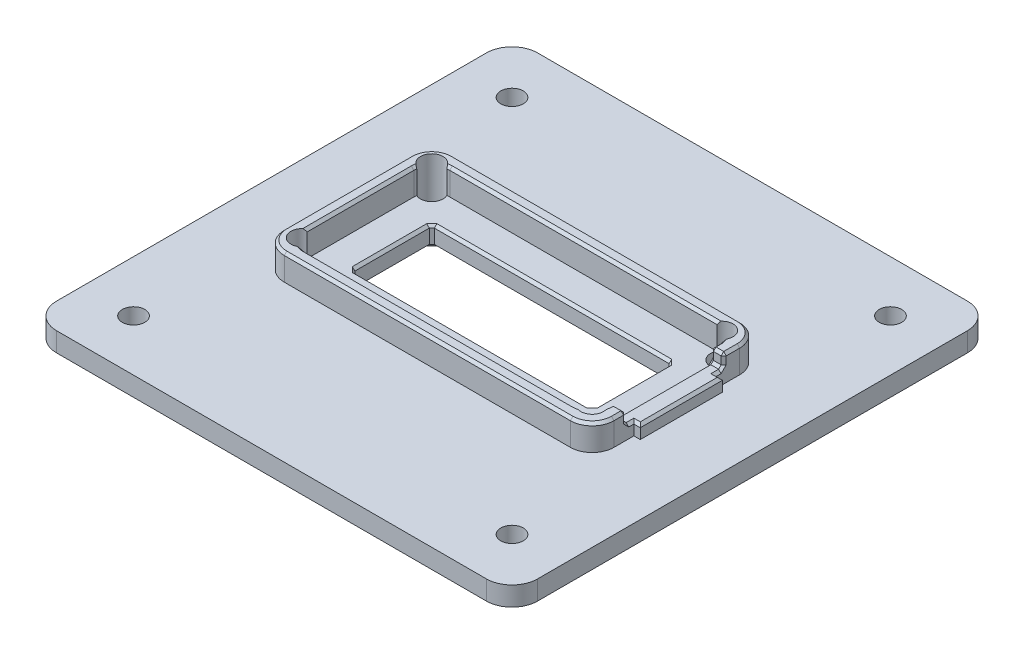
from build123d import *

# Parameters (mm, degrees)
SKETCH_1_W                      = 75
SKETCH_1_H                      = 75
SKETCH_1_R                      = 1.75
SKETCH_1_W_2                    = 37.4
SKETCH_1_H_2                    = 12.4
EXTRUDE_1_DEPTH                 = 3
SKETCH_2_W                      = 51.4
SKETCH_2_H                      = 26.4
SKETCH_2_W_2                    = 47.4
SKETCH_2_H_2                    = 22.4
EXTRUDE_2_DEPTH                 = 4
SKETCH_3_W                      = 2
SKETCH_3_H                      = 15.2
CUT_EXTRUDE_1_DEPTH             = 2
SKETCH_4_W                      = 1
SKETCH_4_H                      = 12.8
EXTRUDE_3_DEPTH                 = 2
FILLET_1_R                      = 2.8
FILLET_2_R                      = 3.4
CHAMFER_1_SIZE                  = 0.4
CUT_EXTRUDE_2_REACH             = 55.184
SKETCH_5_R                      = 1.75
CUT_EXTRUDE_2_DIRECTION_2_DEPTH = 54.183644102
FILLET_3_R                      = 4


with BuildPart() as part:
    # 草图1 → 凸台-拉伸1 (new body)
    with BuildSketch(Plane(origin=(0, 0, 0), x_dir=(1, 0, 0), z_dir=(0, 1, 0))):
        Rectangle(SKETCH_1_W, SKETCH_1_H)
        with Locations(Location((-29.5, 29.5, 0), (0, 0, 270))):
            Circle(SKETCH_1_R, mode=Mode.SUBTRACT)
        with Locations(Location((29.5, 29.5, 0), (0, 0, 270))):
            Circle(SKETCH_1_R, mode=Mode.SUBTRACT)
        with Locations(Location((29.5, -29.5, 0), (0, 0, 270))):
            Circle(SKETCH_1_R, mode=Mode.SUBTRACT)
        with Locations(Location((-29.5, -29.5, 0), (0, 0, 270))):
            Circle(SKETCH_1_R, mode=Mode.SUBTRACT)
        Rectangle(SKETCH_1_W_2, SKETCH_1_H_2, mode=Mode.SUBTRACT)
    extrude(amount=EXTRUDE_1_DEPTH)

    # 草图2 → 凸台-拉伸2 (add)
    with BuildSketch(Plane(origin=(0, 3, 0), x_dir=(1, 0, 0), z_dir=(0, 1, 0))):
        Rectangle(SKETCH_2_W, SKETCH_2_H)
        Rectangle(SKETCH_2_W_2, SKETCH_2_H_2, mode=Mode.SUBTRACT)
    extrude(amount=EXTRUDE_2_DEPTH)

    # 草图3 → 切除-拉伸1 (cut)
    with BuildSketch(Plane(origin=(0, 7, 0), x_dir=(1, 0, 0), z_dir=(0, 1, 0))):
        with Locations((24.7, -0.3)):
            Rectangle(SKETCH_3_W, SKETCH_3_H)
    extrude(amount=-CUT_EXTRUDE_1_DEPTH, mode=Mode.SUBTRACT)

    # 草图4 → 凸台-拉伸3 (add)
    with BuildSketch(Plane(origin=(0, 3, 0), x_dir=(1, 0, 0), z_dir=(0, 1, 0))):
        with Locations((26.2, -0.3)):
            Rectangle(SKETCH_4_W, SKETCH_4_H)
    extrude(amount=EXTRUDE_3_DEPTH)

    # 圆角1
    fillet_1_edges = [part.edges().sort_by_distance(p)[0] for p in [
        (23.7, 5, -11.2),
        (-23.7, 5, -11.2),
        (-23.7, 5, 11.2),
        (23.7, 5, 11.2),
    ]]
    fillet(fillet_1_edges, radius=FILLET_1_R)

    # 圆角2
    fillet_2_edges = [part.edges().sort_by_distance(p)[0] for p in [
        (25.7, 5, 13.2),
        (25.7, 5, -13.2),
        (-25.7, 5, -13.2),
        (-25.7, 5, 13.2),
    ]]
    fillet(fillet_2_edges, radius=FILLET_2_R)

    # 倒角1
    chamfer_1_edges = [part.edges().sort_by_distance(p)[0] for p in [
        (0, 7, 11.2),
        (23.7, 7, 8.15),
        (-23.7, 7, 0),
        (0, 7, -11.2),
        (22.879898987, 7, 10.379898987),
        (-22.879898987, 7, 10.379898987),
        (22.879898987, 7, -10.379898987),
        (-22.879898987, 7, -10.379898987),
        (0, 7, -13.2),
        (-25.7, 7, 0),
        (0, 7, 13.2),
        (25.7, 7, 8.85),
        (-24.704163056, 7, -12.204163056),
        (-24.704163056, 7, 12.204163056),
        (24.704163056, 7, 12.204163056),
        (24.704163056, 7, -12.204163056),
        (18.7, 0, 0),
        (18.7, 1.5, 6.2),
        (0, 0, -6.2),
        (18.7, 1.5, -6.2),
        (-18.7, 0, 0),
        (-18.7, 1.5, -6.2),
        (0, 0, 6.2),
        (-18.7, 1.5, 6.2),
        (18.7, 3, 0),
        (0, 3, -6.2),
        (-18.7, 3, 0),
        (0, 3, 6.2),
        (23.7, 7, -7.85),
        (25.7, 7, -8.55),
        (23.7, 5, 0.3),
        (23.7, 6, 7.9),
        (24.7, 5, -7.3),
        (23.7, 6, -7.3),
        (25.7, 5, 7.3),
        (25.7, 6, -7.3),
        (24.7, 5, 7.9),
        (25.7, 6, 7.9),
        (24.7, 7, 7.9),
        (24.7, 7, -7.3),
        (25.7, 5, -6.7),
        (26.2, 5, 6.7),
        (26.7, 5, 0.3),
        (26.2, 5, -6.1),
    ]]
    chamfer(chamfer_1_edges, length=CHAMFER_1_SIZE)

    # 草图5 → 切除-拉伸2 (cut, up to next)
    with BuildSketch(Plane(origin=(0, 3, 0), x_dir=(1, 0, 0), z_dir=(0, 1, 0)), mode=Mode.PRIVATE) as cut_extrude_2_sk1:
        with Locations(Location((-22.91, 10.4, 0), (0, 0, 40.156544446))):
            Circle(SKETCH_5_R)
    cut_extrude_2_tool1 = extrude(cut_extrude_2_sk1.sketch, amount=-CUT_EXTRUDE_2_REACH, mode=Mode.PRIVATE) & part.part
    # 草图5 → 切除-拉伸2 (cut, up to next)
    with BuildSketch(Plane(origin=(0, 3, 0), x_dir=(1, 0, 0), z_dir=(0, 1, 0)), mode=Mode.PRIVATE) as cut_extrude_2_sk2:
        with Locations(Location((22.3, 10.4, 0), (0, 0, 136.81614849))):
            Circle(SKETCH_5_R)
    cut_extrude_2_tool2 = extrude(cut_extrude_2_sk2.sketch, amount=-CUT_EXTRUDE_2_REACH, mode=Mode.PRIVATE) & part.part
    # 草图5 → 切除-拉伸2 (cut, up to next)
    with BuildSketch(Plane(origin=(0, 3, 0), x_dir=(1, 0, 0), z_dir=(0, 1, 0)), mode=Mode.PRIVATE) as cut_extrude_2_sk3:
        with Locations(Location((22.3, -9.8, 0), (0, 0, 37.891788933))):
            Circle(SKETCH_5_R)
    cut_extrude_2_tool3 = extrude(cut_extrude_2_sk3.sketch, amount=-CUT_EXTRUDE_2_REACH, mode=Mode.PRIVATE) & part.part
    # 草图5 → 切除-拉伸2 (cut, up to next)
    with BuildSketch(Plane(origin=(0, 3, 0), x_dir=(1, 0, 0), z_dir=(0, 1, 0)), mode=Mode.PRIVATE) as cut_extrude_2_sk4:
        with Locations(Location((-22.91, -9.8, 0), (0, 0, 116.835376612))):
            Circle(SKETCH_5_R)
    cut_extrude_2_tool4 = extrude(cut_extrude_2_sk4.sketch, amount=-CUT_EXTRUDE_2_REACH, mode=Mode.PRIVATE) & part.part
    add(cut_extrude_2_tool1.solids().sort_by_distance((-22.91, 3, -10.4))[0], mode=Mode.SUBTRACT)
    add(cut_extrude_2_tool2.solids().sort_by_distance((22.3, 3, -10.4))[0], mode=Mode.SUBTRACT)
    add(cut_extrude_2_tool3.solids().sort_by_distance((22.3, 3, 9.8))[0], mode=Mode.SUBTRACT)
    add(cut_extrude_2_tool4.solids().sort_by_distance((-22.91, 3, 9.8))[0], mode=Mode.SUBTRACT)

    # 草图5 → 切除-拉伸2 direction 2 (cut)
    with BuildSketch(Plane(origin=(0, 3, 0), x_dir=(1, 0, 0), z_dir=(0, 1, 0))):
        with Locations(Location((-22.91, 10.4, 0), (0, 0, 40.156544446))):
            Circle(SKETCH_5_R)
        with Locations(Location((22.3, 10.4, 0), (0, 0, 136.81614849))):
            Circle(SKETCH_5_R)
        with Locations(Location((22.3, -9.8, 0), (0, 0, 37.891788933))):
            Circle(SKETCH_5_R)
        with Locations(Location((-22.91, -9.8, 0), (0, 0, 116.835376612))):
            Circle(SKETCH_5_R)
    extrude(amount=CUT_EXTRUDE_2_DIRECTION_2_DEPTH, mode=Mode.SUBTRACT)

    # 圆角3
    fillet_3_edges = [part.edges().sort_by_distance(p)[0] for p in [
        (37.5, 1.5, 37.5),
        (-37.5, 1.5, 37.5),
        (-37.5, 1.5, -37.5),
        (37.5, 1.5, -37.5),
    ]]
    fillet(fillet_3_edges, radius=FILLET_3_R)


solid = part.part
